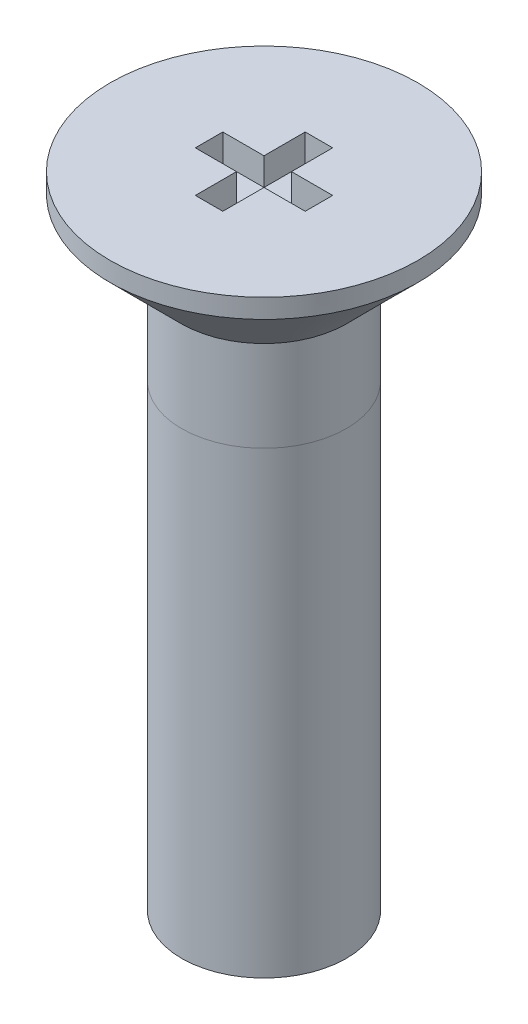
from build123d import *

# Parameters (mm, degrees)
SKETCH1_R           = 1.5
BOSS_EXTRUDE1_DEPTH = 8.35
SKETCH2_R           = 1.5
BOSS_EXTRUDE2_DEPTH = 1.65
SKETCH3_R           = 2.8
BOSS_EXTRUDE3_DEPTH = 1.65
SKETCH7_W           = 0.5
SKETCH7_H           = 0.75
SKETCH7_H_2         = 0.5
SKETCH7_W_2         = 0.75
CUT_EXTRUDE2_DEPTH  = 0.5


with BuildPart() as part:
    # Sketch1 → Boss-Extrude1 (new body)
    with BuildSketch(Plane(origin=(0, 0, 0), x_dir=(1, 0, 0), z_dir=(0, 1, 0))):
        with Locations(Location((0, 0, 0), (0, 0, 270))):
            Circle(SKETCH1_R)
    extrude(amount=BOSS_EXTRUDE1_DEPTH)


with BuildPart() as body_2:
    # Sketch2 → Boss-Extrude2 (new body)
    with BuildSketch(Plane(origin=(0, 8.35, 0), x_dir=(1, 0, 0), z_dir=(0, 1, 0))):
        with Locations(Location((0, 0, 0), (0, 0, 270))):
            Circle(SKETCH2_R)
    extrude(amount=BOSS_EXTRUDE2_DEPTH)


with BuildPart() as body_3:
    # Sketch3 → Boss-Extrude3 (new body)
    with BuildSketch(Plane(origin=(0, 10, 0), x_dir=(1, 0, 0), z_dir=(0, 1, 0))):
        with Locations(Location((0, 0, 0), (0, 0, 270))):
            Circle(SKETCH3_R)
    extrude(amount=BOSS_EXTRUDE3_DEPTH)

    # Sketch6 → Cut-Revolve1 (revolve, cut)
    with BuildSketch(Plane.XY, mode=Mode.PRIVATE) as cut_revolve1_sk:
        Polygon((1.5, 10), (2.8, 10), (2.8, 11.3), align=None)
    revolve(cut_revolve1_sk.sketch.rotate(Axis((0, 0, 0), (0, 1, 0)), 90), axis=Axis((0, 0, 0), (0, 1, 0)), mode=Mode.SUBTRACT)

    # Sketch7 → Cut-Extrude2 (cut)
    with BuildSketch(Plane(origin=(0, 11.65, 0), x_dir=(1, 0, 0), z_dir=(0, 1, 0))):
        with Locations((0, 0.625)):
            Rectangle(SKETCH7_W, SKETCH7_H)
        Rectangle(SKETCH7_W, SKETCH7_H_2)
        with Locations((0.625, 0)):
            Rectangle(SKETCH7_W_2, SKETCH7_H_2)
        with Locations((0, -0.625)):
            Rectangle(SKETCH7_W, SKETCH7_H)
        with Locations((-0.625, 0)):
            Rectangle(SKETCH7_W_2, SKETCH7_H_2)
    extrude(amount=-CUT_EXTRUDE2_DEPTH, mode=Mode.SUBTRACT)


solid = Compound([part.part, body_2.part, body_3.part])
